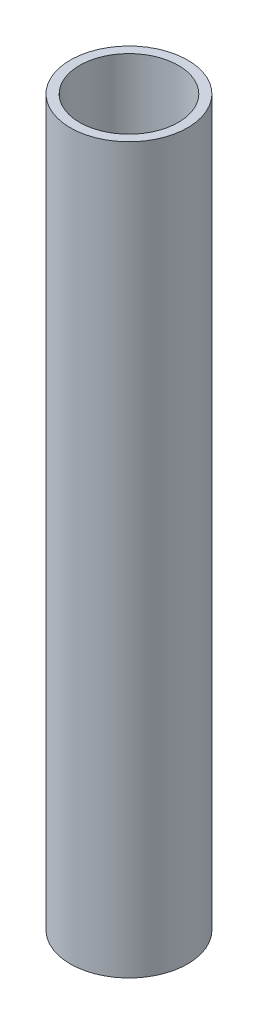
from build123d import *

# Parameters (mm, degrees)
SKETCH1_R           = 30.1625
SKETCH1_R_2         = 25.4
BOSS_EXTRUDE1_DEPTH = 186.182


with BuildPart() as part:
    # Sketch1 → Boss-Extrude1 (new, symmetric)
    with BuildSketch(Plane(origin=(0, 0, 0), x_dir=(1, 0, 0), z_dir=(0, 1, 0))):
        with Locations(Location((0, 0, 0), (0, 0, 270))):
            Circle(SKETCH1_R)
        with Locations(Location((0, 0, 0), (0, 0, 270))):
            Circle(SKETCH1_R_2, mode=Mode.SUBTRACT)
    extrude(amount=BOSS_EXTRUDE1_DEPTH, both=True)


solid = part.part
